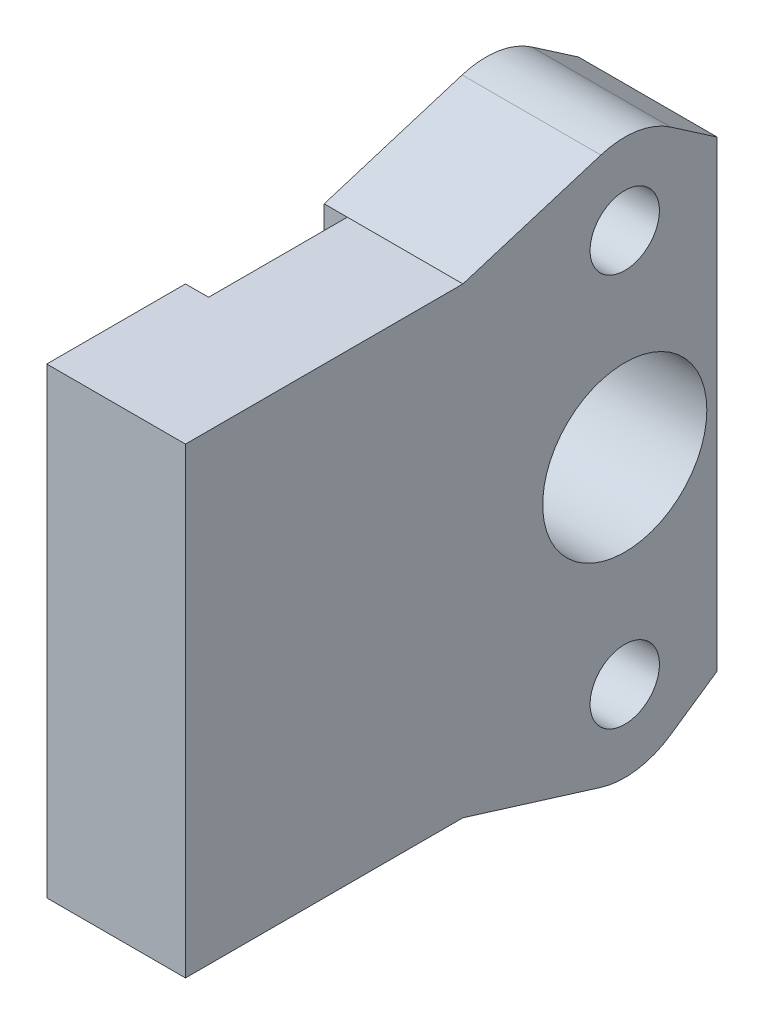
from build123d import *

# Parameters (mm, degrees)
SKETCH1_R           = 3.55
SKETCH1_R_2         = 1.5
BOSS_EXTRUDE1_DEPTH = 6
SKETCH2_W           = 6
SKETCH2_H           = 20
CUT_EXTRUDE1_DEPTH  = 1


with BuildPart() as part:
    # Sketch1 → Boss-Extrude1 (new body)
    with BuildSketch(Plane(origin=(0, 0, 0), x_dir=(0, 0, -1), z_dir=(1, 0, 0))):
        with BuildLine():
            Line((-7, 10), (-1.033439229, 11.843950263))
            ThreePointArc((-1.033439229, 11.843950263), (0.525907674, 11.960263157), (1.980283773, 11.38590994))
            Line((1.980283773, 11.38590994), (4, 10))
            Line((4, 10), (4, -10))
            Line((4, -10), (1.980283773, -11.38590994))
            ThreePointArc((1.980283773, -11.38590994), (0.525907674, -11.960263157), (-1.033439229, -11.843950263))
            Line((-1.033439229, -11.843950263), (-7, -10))
            Line((-7, -10), (-19, -10))
            Line((-19, -10), (-19, 10))
            Line((-19, 10), (-7, 10))
        make_face()
        Circle(SKETCH1_R, mode=Mode.SUBTRACT)
        with Locations((0, -8.5)):
            Circle(SKETCH1_R_2, mode=Mode.SUBTRACT)
        with Locations((0, 8.5)):
            Circle(SKETCH1_R_2, mode=Mode.SUBTRACT)
    extrude(amount=BOSS_EXTRUDE1_DEPTH)

    # Sketch2 → Cut-Extrude1 (cut)
    with BuildSketch(Plane.ZY):
        with Locations((10, 0)):
            Rectangle(SKETCH2_W, SKETCH2_H)
    extrude(amount=-CUT_EXTRUDE1_DEPTH, mode=Mode.SUBTRACT)


solid = part.part
